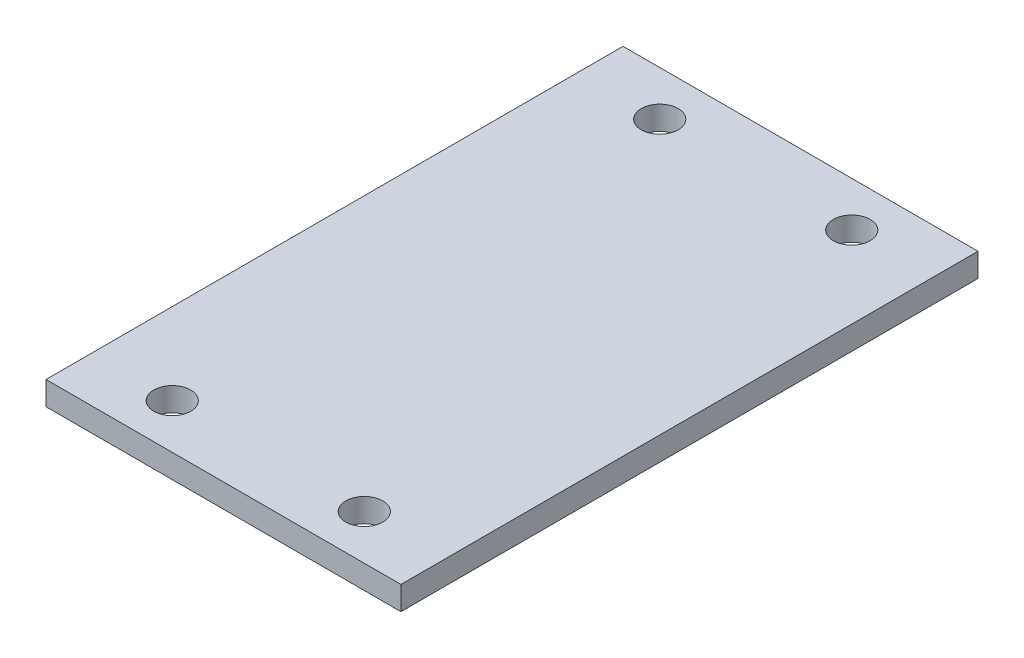
from build123d import *

# Parameters (mm, degrees)
SKETCH1_W           = 24.0284
SKETCH1_H           = 39.0652
SKETCH1_R           = 1.25
BOSS_EXTRUDE1_DEPTH = 1.6


with BuildPart() as part:
    # Sketch1 → Boss-Extrude1 (new body)
    with BuildSketch(Plane(origin=(0, 0, 0), x_dir=(1, 0, 0), z_dir=(0, 1, 0))):
        with Locations((12.0142, 19.5326)):
            Rectangle(SKETCH1_W, SKETCH1_H)
        with Locations(Location((5.5142, 36.0326, 0), (0, 0, 270))):
            Circle(SKETCH1_R, mode=Mode.SUBTRACT)
        with Locations(Location((5.5142, 3.0326, 0), (0, 0, 270))):
            Circle(SKETCH1_R, mode=Mode.SUBTRACT)
        with Locations(Location((18.5142, 36.0326, 0), (0, 0, 270))):
            Circle(SKETCH1_R, mode=Mode.SUBTRACT)
        with Locations(Location((18.5142, 3.0326, 0), (0, 0, 270))):
            Circle(SKETCH1_R, mode=Mode.SUBTRACT)
    extrude(amount=BOSS_EXTRUDE1_DEPTH)


solid = part.part
